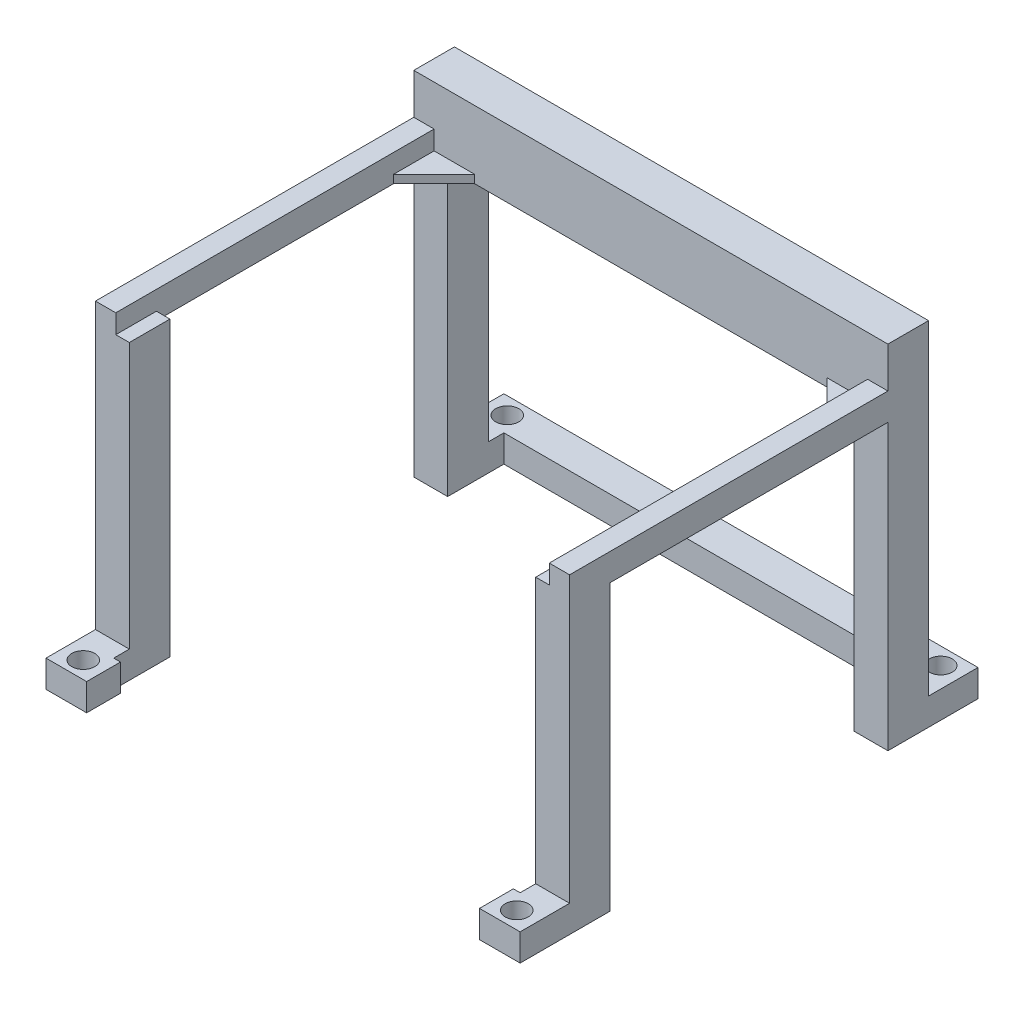
from build123d import *

# Parameters (mm, degrees)
SKETCH1_R                      = 4.25
BOSS_EXTRUDE1_DEPTH            = 10
BOSS_EXTRUDE2_START            = -5
BOSS_EXTRUDE2_DEPTH            = 15
SKETCH3_W                      = 175
SKETCH3_H                      = 10
BOSS_EXTRUDE3_DEPTH            = 51.25
SKETCH4_W                      = 160
SKETCH4_H                      = 117.5
CUT_EXTRUDE1_DEPTH             = 10
CUT_EXTRUDE1_DIRECTION_2_REACH = 219.644
SKETCH5_W                      = 175
SKETCH5_H                      = 117.5
CUT_EXTRUDE2_DEPTH             = 15
SKETCH6_W                      = 5
SKETCH6_H                      = 15
BOSS_EXTRUDE4_DEPTH            = 3
CUT_EXTRUDE3_REACH             = 222.327
SKETCH7_W                      = 145
SKETCH7_H                      = 12.5


with BuildPart() as part:
    # Sketch1 → Boss-Extrude1 (new body)
    with BuildSketch(Plane(origin=(0, 0, 0), x_dir=(1, 0, 0), z_dir=(0, 1, 0))):
        Polygon((-87.5, 6.25), (87.5, 6.25), (87.5, -17), (75, -17), (75, -6.25), (-75, -6.25), (-75, -17), (-87.5, -17), align=None)
        with Locations(Location((-80, 0, 0), (0, 0, 270))):
            Circle(SKETCH1_R, mode=Mode.SUBTRACT)
        with Locations(Location((80, 0, 0), (0, 0, 270))):
            Circle(SKETCH1_R, mode=Mode.SUBTRACT)
    boss_extrude1 = extrude(amount=BOSS_EXTRUDE1_DEPTH)

    # Sketch2 → Boss-Extrude2 (add)
    with BuildSketch(Plane.XY.offset(17).offset(BOSS_EXTRUDE2_START)):
        Polygon((87.5, 130), (-87.5, 130), (-87.5, 0), (-75, 0), (-75, 105), (75, 105), (75, 0), (87.5, 0), align=None)
    boss_extrude2 = extrude(amount=BOSS_EXTRUDE2_DEPTH)

    # Sketch3 → Boss-Extrude3 (add)
    with BuildSketch(Plane.XY.offset(27)):
        with Locations((0, 110)):
            Rectangle(SKETCH3_W, SKETCH3_H)
    boss_extrude3 = extrude(amount=BOSS_EXTRUDE3_DEPTH)

    # Mirror2: Boss-Extrude1, Boss-Extrude2, Boss-Extrude3 across plane
    add(boss_extrude1.mirror(Plane.XY.offset(78.25)))
    add(boss_extrude2.mirror(Plane.XY.offset(78.25)))
    add(boss_extrude3.mirror(Plane.XY.offset(78.25)))

    # Sketch4 → Cut-Extrude1 (cut)
    with BuildSketch(Plane(origin=(0, 115, 0), x_dir=(1, 0, 0), z_dir=(0, 1, 0))):
        with Locations((0, -85.75)):
            Rectangle(SKETCH4_W, SKETCH4_H)
    extrude(amount=-CUT_EXTRUDE1_DEPTH, mode=Mode.SUBTRACT)

    # Cut-Extrude1 direction 2: up to this face of the body (flat: up to its plane)
    cut_extrude1_direction_2_end = Plane(part.part.faces().sort_by_distance((0, 130, 137))[0])
    # Sketch4 → Cut-Extrude1 direction 2 (cut, up to the picked face)
    with BuildSketch(Plane(origin=(0, 115, 0), x_dir=(1, 0, 0), z_dir=(0, 1, 0)), mode=Mode.PRIVATE) as cut_extrude1_direction_2_sk1:
        with Locations((0, -85.75)):
            Rectangle(SKETCH4_W, SKETCH4_H)
    cut_extrude1_direction_2_tool1 = split(extrude(cut_extrude1_direction_2_sk1.sketch, amount=CUT_EXTRUDE1_DIRECTION_2_REACH, mode=Mode.PRIVATE), bisect_by=cut_extrude1_direction_2_end, keep=Keep.BOTH, mode=Mode.PRIVATE)
    add(cut_extrude1_direction_2_tool1.solids().sort_by(Axis((0, 115, 85.75), (0, 1, 0)))[0], mode=Mode.SUBTRACT)

    # Sketch5 → Cut-Extrude2 (cut)
    with BuildSketch(Plane(origin=(0, 115, 0), x_dir=(1, 0, 0), z_dir=(0, 1, 0))):
        with Locations((0, -85.75)):
            Rectangle(SKETCH5_W, SKETCH5_H)
    extrude(amount=CUT_EXTRUDE2_DEPTH, mode=Mode.SUBTRACT)

    # Sketch6 → Boss-Extrude4 (add)
    with BuildSketch(Plane(origin=(0, 105, 0), x_dir=(1, 0, 0), z_dir=(0, 1, 0))):
        with Locations((-77.5, -137)):
            Rectangle(SKETCH6_W, SKETCH6_H)
        with Locations((77.5, -137)):
            Rectangle(SKETCH6_W, SKETCH6_H)
        Polygon((-80, -27), (-65, -27), (-80, -42), align=None)
        Polygon((80, -27), (65, -27), (80, -42), align=None)
    extrude(amount=BOSS_EXTRUDE4_DEPTH)

    # Sketch7 → Cut-Extrude3 (cut, up to next)
    with BuildSketch(Plane(origin=(0, 10, 0), x_dir=(1, 0, 0), z_dir=(0, 1, 0)), mode=Mode.PRIVATE) as cut_extrude3_sk1:
        with Locations((0, -156.5)):
            Rectangle(SKETCH7_W, SKETCH7_H)
    cut_extrude3_tool1 = extrude(cut_extrude3_sk1.sketch, amount=-CUT_EXTRUDE3_REACH, mode=Mode.PRIVATE) & part.part
    add(cut_extrude3_tool1.solids().sort_by_distance((0, 10, 156.5))[0], mode=Mode.SUBTRACT)


solid = part.part
